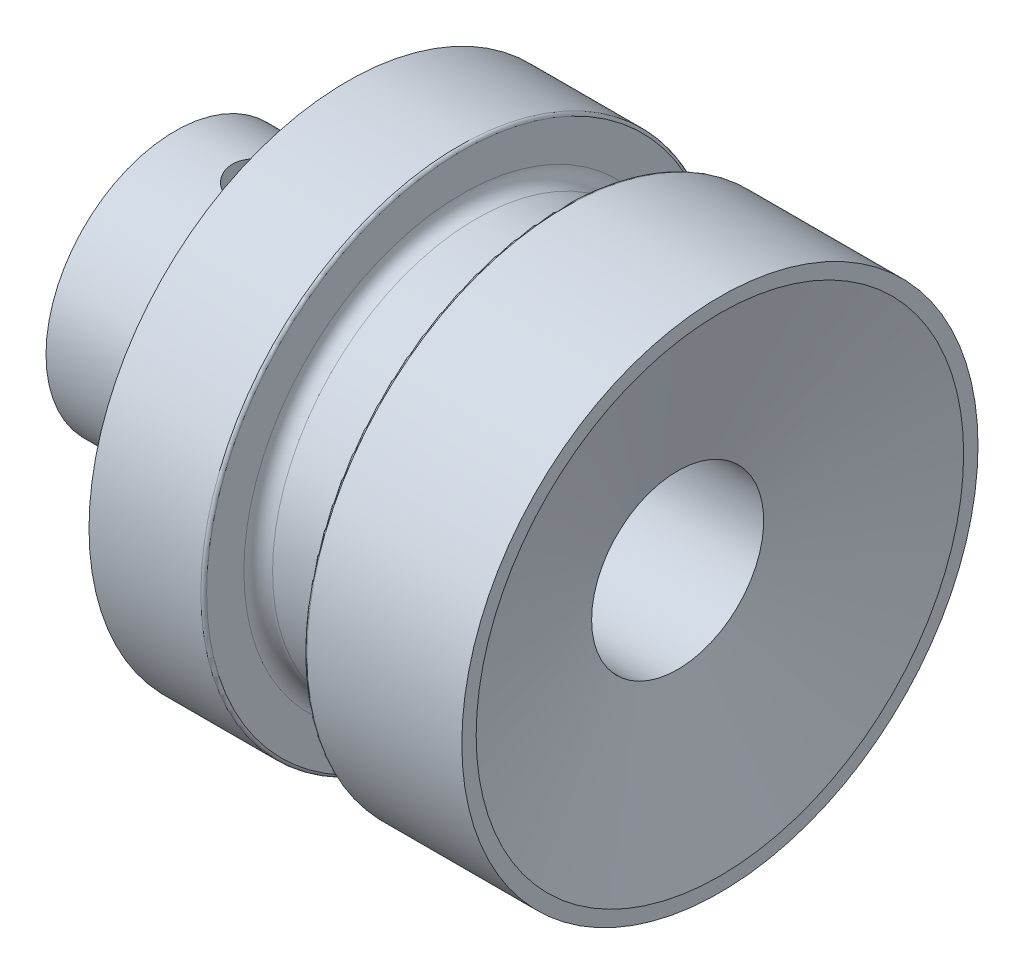
from build123d import *

# Parameters (mm, degrees)
CUT_EXTRUDE_1_DEPTH      = 23.869193331
CUT_EXTRUDE_1_DEPTH_BACK = 23.869193331
SKETCH_2_R               = 1


with BuildPart() as part:
    # Эскиз1 → Повернуть1 (revolve)
    with BuildSketch(Plane.XY, mode=Mode.PRIVATE) as revolve_1_sk:
        with BuildLine():
            Line((0, 3), (0, 4.5))
            Line((0, 4.5), (6, 4.5))
            Line((6, 4.5), (6, 9))
            Line((6, 9), (9.9, 9))
            ThreePointArc((9.9, 9), (9.970710678, 8.970710678), (10, 8.9))
            Line((10, 8.9), (10, 7.6))
            ThreePointArc((10, 7.6), (10.146446609, 7.246446609), (10.5, 7.1))
            Line((10.5, 7.1), (13, 7.1))
            ThreePointArc((13, 7.1), (13.353553391, 7.246446609), (13.5, 7.6))
            Line((13.5, 7.6), (13.5, 8.9))
            ThreePointArc((13.5, 8.9), (13.529289322, 8.970710678), (13.6, 9))
            Line((13.6, 9), (19, 9))
            Line((19, 9), (19, 8.5))
            Line((19, 8.5), (17.526279442, 3))
            Line((17.526279442, 3), (0, 3))
        make_face()
    revolve(revolve_1_sk.sketch.rotate(Axis((0, 0, 0), (1, 0, 0)), 90), axis=Axis((0, 0, 0), (1, 0, 0)))

    # Эскиз2 → Вырез-Вытянуть1 (cut, two sides: drawn at the far end of the back side and taken through both)
    with BuildSketch(Plane(origin=(0, 0, 0), x_dir=(1, 0, 0), z_dir=(0, 1, 0)).offset(-CUT_EXTRUDE_1_DEPTH_BACK)):
        with Locations(Location((3, 0, 0), (0, 0, 270))):
            Circle(SKETCH_2_R)
    extrude(amount=CUT_EXTRUDE_1_DEPTH + CUT_EXTRUDE_1_DEPTH_BACK, mode=Mode.SUBTRACT)


solid = part.part
